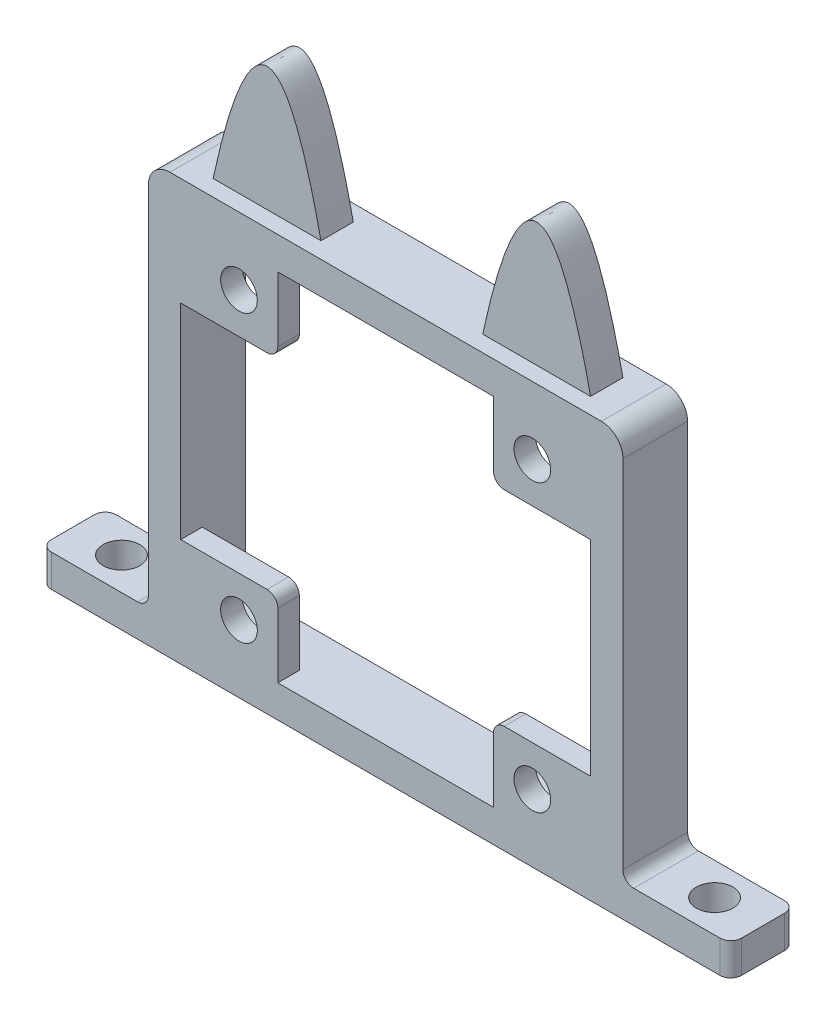
from build123d import *

# Parameters (mm, degrees)
SKETCH_1_W          = 44
SKETCH_1_H          = 39
SKETCH_1_W_2        = 38
SKETCH_1_H_2        = 33
EXTRUDE_1_DEPTH     = 6
SKETCH_2_W          = 9
SKETCH_2_H          = 7
EXTRUDE_2_DEPTH     = 2
SKETCH_3_R          = 1.7
CUT_EXTRUDE_1_DEPTH = 30.669007398
EXTRUDE_3_DEPTH     = 1.5
SKETCH_5_W          = 10
SKETCH_5_H          = 3
EXTRUDE_4_DEPTH     = 6
FILLET_3_R          = 1
FILLET_4_R          = 2
SKETCH_6_R          = 1.7
CUT_EXTRUDE_2_DEPTH = 3


with BuildPart() as part:
    # 草图1 → 凸台-拉伸1 (new body)
    with BuildSketch(Plane.XY):
        Rectangle(SKETCH_1_W, SKETCH_1_H)
        Rectangle(SKETCH_1_W_2, SKETCH_1_H_2, mode=Mode.SUBTRACT)
    extrude(amount=EXTRUDE_1_DEPTH)

    # 草图2 → 凸台-拉伸2 (add)
    with BuildSketch(Plane.XY.offset(6)):
        with Locations((14.5, 13)):
            Rectangle(SKETCH_2_W, SKETCH_2_H)
        with Locations((-14.5, 13)):
            Rectangle(SKETCH_2_W, SKETCH_2_H)
        with Locations((-14.5, -13)):
            Rectangle(SKETCH_2_W, SKETCH_2_H)
        with Locations((14.5, -13)):
            Rectangle(SKETCH_2_W, SKETCH_2_H)
    extrude(amount=-EXTRUDE_2_DEPTH)

    # 草图3 → 切除-拉伸1 (cut, through all)
    with BuildSketch(Plane(origin=(0, 0, 4), x_dir=(-1, 0, 0), z_dir=(0, 0, -1))):
        with Locations((-13.6, 13.25)):
            Circle(SKETCH_3_R)
        with Locations(Location((13.6, 13.25, 0), (0, 0, 180))):
            Circle(SKETCH_3_R)
        with Locations((13.6, -13.25)):
            Circle(SKETCH_3_R)
        with Locations(Location((-13.6, -13.25, 0), (0, 0, 180))):
            Circle(SKETCH_3_R)
    extrude(amount=-CUT_EXTRUDE_1_DEPTH, mode=Mode.SUBTRACT)

    # 草图4 → 凸台-拉伸3 (add, symmetric)
    with BuildSketch(Plane(origin=(0, 0, 3), x_dir=(-1, 0, 0), z_dir=(0, 0, -1))):
        with BuildLine():
            Line((7.5, 19.5), (17.5, 19.5))
            add(Edge.make_bspline(
                [(7.5, 19.5), (12.5, 42.5), (17.5, 19.5)],
                knots=[0, 0, 0, 1, 1, 1], degree=2))
        make_face()
        with BuildLine():
            Line((-7.5, 19.5), (-17.5, 19.5))
            add(Edge.make_bspline(
                [(-7.5, 19.5), (-12.5, 42.5), (-17.5, 19.5)],
                knots=[0, 0, 0, 1, 1, 1], degree=2))
        make_face()
    extrude(amount=EXTRUDE_3_DEPTH, both=True)

    # 草图5 → 凸台-拉伸4 (add)
    with BuildSketch(Plane(origin=(0, 0, 0), x_dir=(-1, 0, 0), z_dir=(0, 0, -1))):
        with Locations((27, -18)):
            Rectangle(SKETCH_5_W, SKETCH_5_H)
        with Locations((-27, -18)):
            Rectangle(SKETCH_5_W, SKETCH_5_H)
    extrude(amount=-EXTRUDE_4_DEPTH)

    # 圆角3
    fillet_3_edges = [part.edges().sort_by_distance(p)[0] for p in [
        (-22, -16.5, 3),
        (-32, -18, 0),
        (-32, -18, 6),
        (22, -16.5, 3),
        (32, -18, 0),
        (32, -18, 6),
        (19, 16.5, 2),
        (10, 9.5, 5),
        (-19, 16.5, 2),
        (-10, 9.5, 5),
        (-19, -16.5, 2),
        (-10, -9.5, 5),
        (19, -16.5, 2),
        (10, -9.5, 5),
    ]]
    fillet(fillet_3_edges, radius=FILLET_3_R)

    # 圆角4
    fillet_4_edges = [part.edges().sort_by_distance(p)[0] for p in [
        (-22, 19.5, 3),
        (22, 19.5, 3),
    ]]
    fillet(fillet_4_edges, radius=FILLET_4_R)

    # 草图6 → 切除-拉伸2 (cut)
    with BuildSketch(Plane(origin=(0, -16.5, 0), x_dir=(1, 0, 0), z_dir=(0, 1, 0))):
        with Locations(Location((-27.5, -3, 0), (0, 0, 270))):
            Circle(SKETCH_6_R)
        with Locations(Location((27.5, -3, 0), (0, 0, 90))):
            Circle(SKETCH_6_R)
    extrude(amount=-CUT_EXTRUDE_2_DEPTH, mode=Mode.SUBTRACT)


solid = part.part
